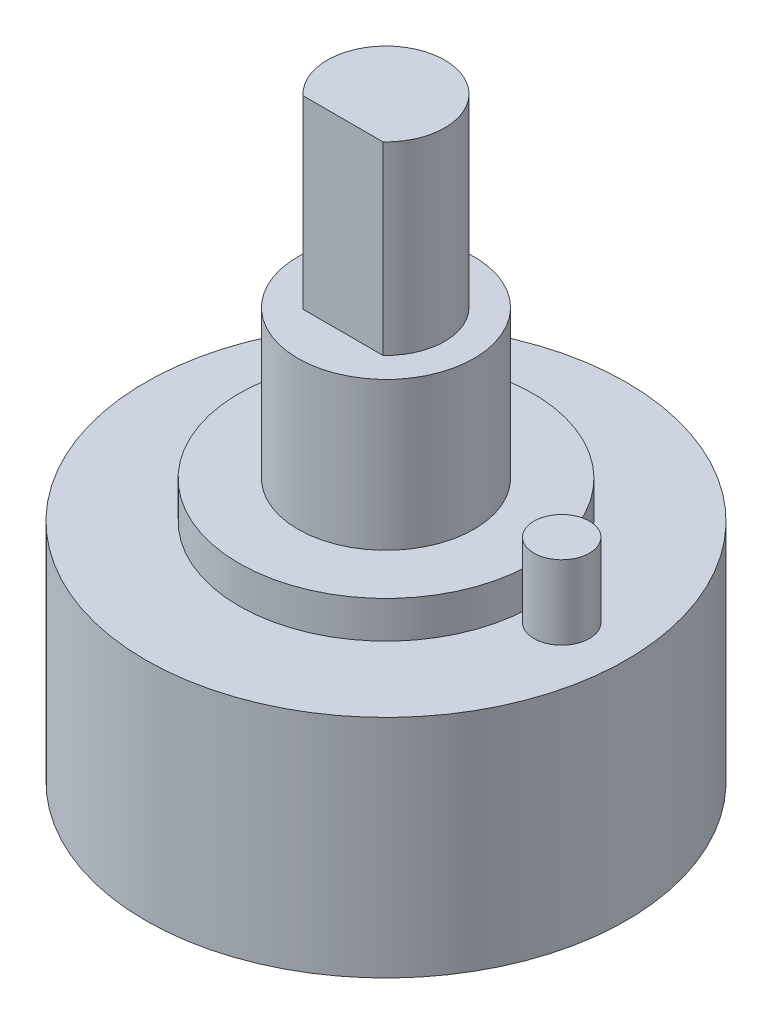
from build123d import *

# Parameters (mm, degrees)
CUT_EXTRUDE1_DEPTH  = 10
SKETCH6_R           = 1.5
BOSS_EXTRUDE3_DEPTH = 4
SKETCH7_R           = 0.5
BOSS_EXTRUDE4_DEPTH = 6.3


with BuildPart() as part:
    # Sketch1 → Revolve1 (revolve)
    with BuildSketch(Plane(origin=(0, 0, 0), x_dir=(0, 0, -1), z_dir=(1, 0, 0))):
        Polygon((0, 0), (-13, 0), (-13, 12.2), (-7.95, 12.2), (-7.95, 14.2), (-4.7625, 14.2), (-4.7625, 22.2), (-3.175, 22.2), (-3.175, 32.2), (0, 32.2), align=None)
    revolve(axis=Axis((0, 0, 0), (0, -1, 0)))

    # Sketch3 → Cut-Extrude1 (cut)
    with BuildSketch(Plane(origin=(0, 32.2, 0), x_dir=(1, 0, 0), z_dir=(0, 1, 0))):
        with BuildLine():
            Line((-2.162174831, -2.325), (2.162174831, -2.325))
            ThreePointArc((2.162174831, -2.325), (0, -3.175), (-2.162174831, -2.325))
        make_face()
    extrude(amount=-CUT_EXTRUDE1_DEPTH, mode=Mode.SUBTRACT)

    # Sketch6 → Boss-Extrude3 (add)
    with BuildSketch(Plane(origin=(0, 12.2, 0), x_dir=(1, 0, 0), z_dir=(0, 1, 0))):
        with Locations(Location((9.5, 0, 0), (0, 0, 270))):
            Circle(SKETCH6_R)
    extrude(amount=BOSS_EXTRUDE3_DEPTH)

    # Sketch7 → Boss-Extrude4 (add)
    with BuildSketch(Plane.XZ):
        with Locations(Location((-2.847009496, -10.625184089, 0), (0, 0, 270))):
            Circle(SKETCH7_R)
        with Locations(Location((-7.778174593, -7.778174593, 0), (0, 0, 270))):
            Circle(SKETCH7_R)
        with Locations(Location((-2.828427125, -2.828427125, 0), (0, 0, 270))):
            Circle(SKETCH7_R)
        with Locations(Location((-10.625184089, -2.847009496, 0), (0, 0, 270))):
            Circle(SKETCH7_R)
        with Locations(Location((-10.625184089, 2.847009496, 0), (0, 0, 270))):
            Circle(SKETCH7_R)
    extrude(amount=BOSS_EXTRUDE4_DEPTH)


solid = part.part
